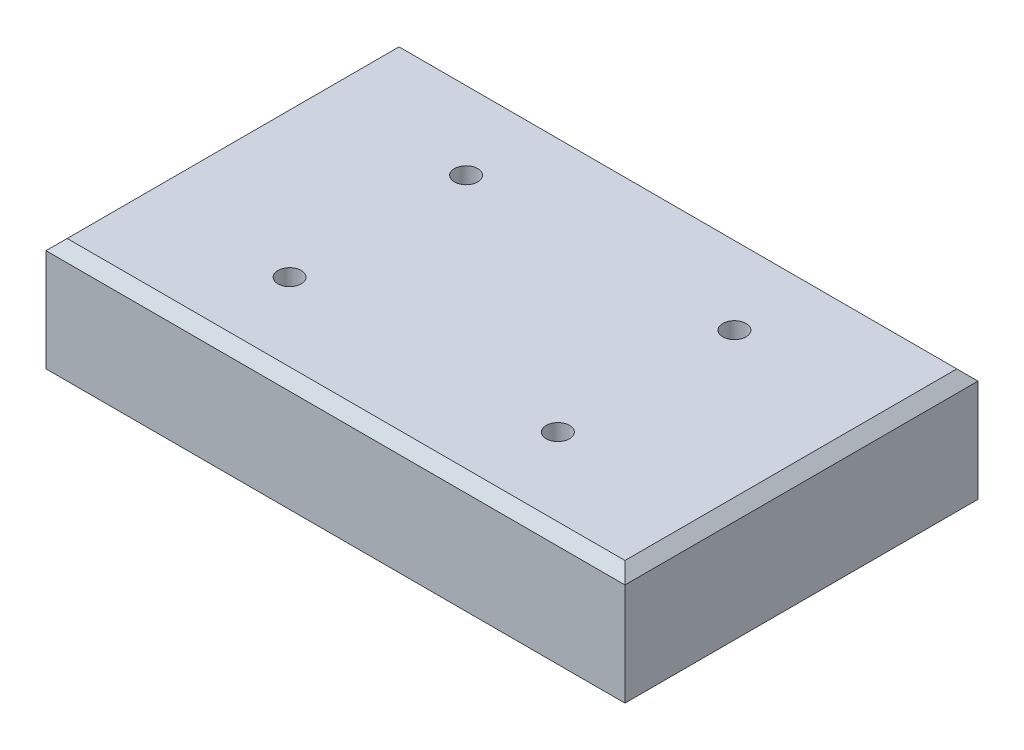
from build123d import *

# Parameters (mm, degrees)
SKETCH1_W             = 82
SKETCH1_H             = 50
BOSS_EXTRUDE1_DEPTH   = 16
M4_TAPPED_HOLE1_D     = 3.3
M4_TAPPED_HOLE1_DEPTH = 7.008579979
M4_TAPPED_HOLE1_TIP   = 0.991420021
CHAMFER1_SIZE         = 1.5


with BuildPart() as part:
    # Sketch1 → Boss-Extrude1 (new body)
    with BuildSketch(Plane(origin=(0, 0, 0), x_dir=(1, 0, 0), z_dir=(0, 1, 0))):
        Rectangle(SKETCH1_W, SKETCH1_H)
    extrude(amount=BOSS_EXTRUDE1_DEPTH)

    # M4 Tapped Hole1
    with Locations(Plane(origin=(0, 16, 0), x_dir=(1, 0, 0), z_dir=(0, 1, 0))):
        with Locations((-19, 12.5), (19, 12.5), (19, -12.5), (-19, -12.5)):
            Hole(M4_TAPPED_HOLE1_D / 2, depth=M4_TAPPED_HOLE1_DEPTH)
            with Locations((0, 0, -(M4_TAPPED_HOLE1_DEPTH + M4_TAPPED_HOLE1_TIP / 2))):  # 118° drill point
                Cone(0, M4_TAPPED_HOLE1_D / 2, M4_TAPPED_HOLE1_TIP, mode=Mode.SUBTRACT)

    # Chamfer1
    chamfer1_edges = [part.edges().sort_by_distance(p)[0] for p in [
        (-41, 16, 0),
        (0, 16, 25),
        (41, 16, 0),
        (0, 16, -25),
    ]]
    chamfer(chamfer1_edges, length=CHAMFER1_SIZE)


solid = part.part
